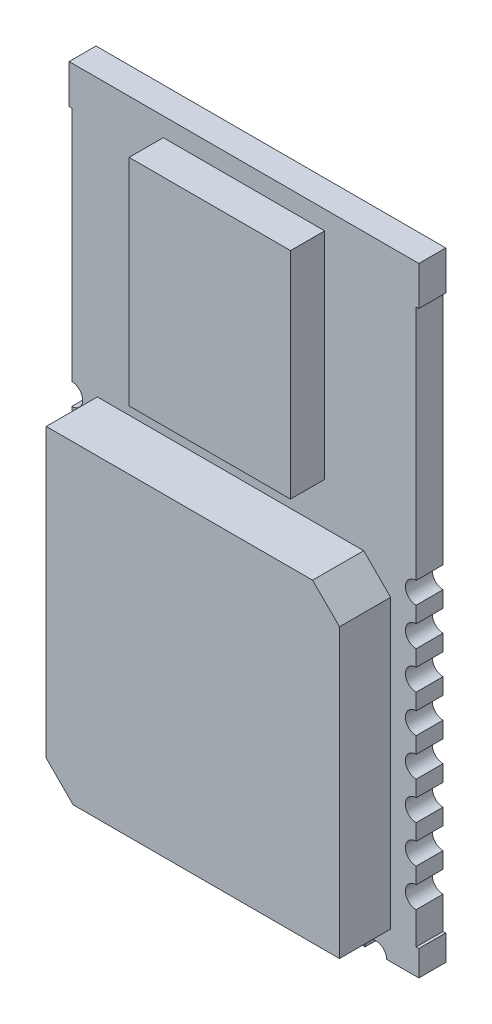
from build123d import *

# Parameters (mm, degrees)
SKETCH_1_W             = 13
SKETCH_1_H             = 23
EXTRUDE_1_DEPTH        = 1
SKETCH_2_W             = 1
SKETCH_2_H             = 20.6
CUT_EXTRUDE_1_DEPTH    = 0.1
CUT_EXTRUDE_3_REACH    = 15.248
PATTERN_LINEAR_8_COUNT = 4
PATTERN_LINEAR_8_PITCH = 1.4
MIRROR_3_COPY_1_REACH  = 15.248
MIRROR_3_COPY_2_REACH  = 15.248
MIRROR_3_COPY_3_REACH  = 15.248
CUT_EXTRUDE_4_REACH    = 15.248
PATTERN_LINEAR_9_COUNT = 8
PATTERN_LINEAR_9_PITCH = 1.4
MIRROR_4_COPY_1_REACH  = 15.248
MIRROR_4_COPY_2_REACH  = 15.248
MIRROR_4_COPY_3_REACH  = 15.248
MIRROR_4_COPY_4_REACH  = 15.248
MIRROR_4_COPY_5_REACH  = 15.248
MIRROR_4_COPY_6_REACH  = 15.248
MIRROR_4_COPY_7_REACH  = 15.248
SKETCH_12_W            = 10.9
SKETCH_12_H            = 11.68
EXTRUDE_2_DEPTH        = 1.9
CHAMFER_1_SIZE         = 1
CHAMFER_2_SIZE         = 1
SKETCH_13_W            = 6
SKETCH_13_H            = 8
EXTRUDE_3_DEPTH        = 1.27


with BuildPart() as part:
    # 草图1 → 凸台-拉伸1 (new body)
    with BuildSketch(Plane.XY):
        Rectangle(SKETCH_1_W, SKETCH_1_H)
    extrude(amount=-EXTRUDE_1_DEPTH)

    # 草图2 → 切除-拉伸1 (cut)
    with BuildSketch(Plane(origin=(6.5, 0, 0), x_dir=(0, 0, -1), z_dir=(1, 0, 0))):
        with Locations((0.5, -0.25)):
            Rectangle(SKETCH_2_W, SKETCH_2_H)
    cut_extrude_1 = extrude(amount=-CUT_EXTRUDE_1_DEPTH, mode=Mode.SUBTRACT)

    # 镜向1: 切除-拉伸1 across plane
    add(cut_extrude_1.mirror(Plane.ZY), mode=Mode.SUBTRACT)

    # 草图5 → 切除-拉伸3 (cut, up to next)
    with BuildSketch(Plane.XY, mode=Mode.PRIVATE) as cut_extrude_3_sk1:
        with BuildLine():
            Line((0.3, -11.5), (1.1, -11.5))
            ThreePointArc((1.1, -11.5), (0.7, -11.1), (0.3, -11.5))
        make_face()
    cut_extrude_3_tool1 = extrude(cut_extrude_3_sk1.sketch, amount=-CUT_EXTRUDE_3_REACH, mode=Mode.PRIVATE) & part.part
    cut_extrude_3 = cut_extrude_3_tool1.solids().sort_by_distance((0.7, -11.330235, 0))[0]
    add(cut_extrude_3, mode=Mode.SUBTRACT)

    # 阵列(线性)8: 切除-拉伸3 ×4
    with Locations(*[(i * PATTERN_LINEAR_8_PITCH, 0, 0) for i in range(1, PATTERN_LINEAR_8_COUNT)]):
        add(cut_extrude_3, mode=Mode.SUBTRACT)

    # 镜向3: 切除-拉伸3 across plane
    add(cut_extrude_3.mirror(Plane.ZY), mode=Mode.SUBTRACT)

    # 镜向3 copy 1 sketch → 镜向3 copy 1 (cut, up to next)
    with BuildSketch(Plane(origin=(-1.4, 0, 0), x_dir=(-1, 0, 0), z_dir=(0, 0, 1)), mode=Mode.PRIVATE) as mirror_3_copy_1_sk1:
        with BuildLine():
            Line((0.3, 11.5), (1.1, 11.5))
            ThreePointArc((1.1, 11.5), (0.7, 11.1), (0.3, 11.5))
        make_face()
    mirror_3_copy_1_tool1 = extrude(mirror_3_copy_1_sk1.sketch, amount=-MIRROR_3_COPY_1_REACH, mode=Mode.PRIVATE) & part.part
    add(mirror_3_copy_1_tool1.solids().sort_by_distance((-2.1, -11.330235, 0))[0], mode=Mode.SUBTRACT)

    # 镜向3 copy 2 sketch → 镜向3 copy 2 (cut, up to next)
    with BuildSketch(Plane(origin=(-2.8, 0, 0), x_dir=(-1, 0, 0), z_dir=(0, 0, 1)), mode=Mode.PRIVATE) as mirror_3_copy_2_sk1:
        with BuildLine():
            Line((0.3, 11.5), (1.1, 11.5))
            ThreePointArc((1.1, 11.5), (0.7, 11.1), (0.3, 11.5))
        make_face()
    mirror_3_copy_2_tool1 = extrude(mirror_3_copy_2_sk1.sketch, amount=-MIRROR_3_COPY_2_REACH, mode=Mode.PRIVATE) & part.part
    add(mirror_3_copy_2_tool1.solids().sort_by_distance((-3.5, -11.330235, 0))[0], mode=Mode.SUBTRACT)

    # 镜向3 copy 3 sketch → 镜向3 copy 3 (cut, up to next)
    with BuildSketch(Plane(origin=(-4.2, 0, 0), x_dir=(-1, 0, 0), z_dir=(0, 0, 1)), mode=Mode.PRIVATE) as mirror_3_copy_3_sk1:
        with BuildLine():
            Line((0.3, 11.5), (1.1, 11.5))
            ThreePointArc((1.1, 11.5), (0.7, 11.1), (0.3, 11.5))
        make_face()
    mirror_3_copy_3_tool1 = extrude(mirror_3_copy_3_sk1.sketch, amount=-MIRROR_3_COPY_3_REACH, mode=Mode.PRIVATE) & part.part
    add(mirror_3_copy_3_tool1.solids().sort_by_distance((-4.9, -11.330235, 0))[0], mode=Mode.SUBTRACT)

    # 草图11 → 切除-拉伸4 (cut, up to next)
    with BuildSketch(Plane.XY, mode=Mode.PRIVATE) as cut_extrude_4_sk1:
        with BuildLine():
            Line((-6.4, -8.55), (-6.4, -9.35))
            ThreePointArc((-6.4, -9.35), (-6, -8.95), (-6.4, -8.55))
        make_face()
    cut_extrude_4_tool1 = extrude(cut_extrude_4_sk1.sketch, amount=-CUT_EXTRUDE_4_REACH, mode=Mode.PRIVATE) & part.part
    cut_extrude_4 = cut_extrude_4_tool1.solids().sort_by_distance((-6.230235, -8.95, 0))[0]
    add(cut_extrude_4, mode=Mode.SUBTRACT)

    # 阵列(线性)9: 切除-拉伸4 ×8
    with Locations(*[(0, i * PATTERN_LINEAR_9_PITCH, 0) for i in range(1, PATTERN_LINEAR_9_COUNT)]):
        add(cut_extrude_4, mode=Mode.SUBTRACT)

    # 镜向4: 切除-拉伸4 across plane
    add(cut_extrude_4.mirror(Plane.ZY), mode=Mode.SUBTRACT)

    # 镜向4 copy 1 sketch → 镜向4 copy 1 (cut, up to next)
    with BuildSketch(Plane(origin=(0, 1.4, 0), x_dir=(-1, 0, 0), z_dir=(0, 0, 1)), mode=Mode.PRIVATE) as mirror_4_copy_1_sk1:
        with BuildLine():
            Line((-6.4, 8.55), (-6.4, 9.35))
            ThreePointArc((-6.4, 9.35), (-6, 8.95), (-6.4, 8.55))
        make_face()
    mirror_4_copy_1_tool1 = extrude(mirror_4_copy_1_sk1.sketch, amount=-MIRROR_4_COPY_1_REACH, mode=Mode.PRIVATE) & part.part
    add(mirror_4_copy_1_tool1.solids().sort_by_distance((6.230235, -7.55, 0))[0], mode=Mode.SUBTRACT)

    # 镜向4 copy 2 sketch → 镜向4 copy 2 (cut, up to next)
    with BuildSketch(Plane(origin=(0, 2.8, 0), x_dir=(-1, 0, 0), z_dir=(0, 0, 1)), mode=Mode.PRIVATE) as mirror_4_copy_2_sk1:
        with BuildLine():
            Line((-6.4, 8.55), (-6.4, 9.35))
            ThreePointArc((-6.4, 9.35), (-6, 8.95), (-6.4, 8.55))
        make_face()
    mirror_4_copy_2_tool1 = extrude(mirror_4_copy_2_sk1.sketch, amount=-MIRROR_4_COPY_2_REACH, mode=Mode.PRIVATE) & part.part
    add(mirror_4_copy_2_tool1.solids().sort_by_distance((6.230235, -6.15, 0))[0], mode=Mode.SUBTRACT)

    # 镜向4 copy 3 sketch → 镜向4 copy 3 (cut, up to next)
    with BuildSketch(Plane(origin=(0, 4.2, 0), x_dir=(-1, 0, 0), z_dir=(0, 0, 1)), mode=Mode.PRIVATE) as mirror_4_copy_3_sk1:
        with BuildLine():
            Line((-6.4, 8.55), (-6.4, 9.35))
            ThreePointArc((-6.4, 9.35), (-6, 8.95), (-6.4, 8.55))
        make_face()
    mirror_4_copy_3_tool1 = extrude(mirror_4_copy_3_sk1.sketch, amount=-MIRROR_4_COPY_3_REACH, mode=Mode.PRIVATE) & part.part
    add(mirror_4_copy_3_tool1.solids().sort_by_distance((6.230235, -4.75, 0))[0], mode=Mode.SUBTRACT)

    # 镜向4 copy 4 sketch → 镜向4 copy 4 (cut, up to next)
    with BuildSketch(Plane(origin=(0, 5.6, 0), x_dir=(-1, 0, 0), z_dir=(0, 0, 1)), mode=Mode.PRIVATE) as mirror_4_copy_4_sk1:
        with BuildLine():
            Line((-6.4, 8.55), (-6.4, 9.35))
            ThreePointArc((-6.4, 9.35), (-6, 8.95), (-6.4, 8.55))
        make_face()
    mirror_4_copy_4_tool1 = extrude(mirror_4_copy_4_sk1.sketch, amount=-MIRROR_4_COPY_4_REACH, mode=Mode.PRIVATE) & part.part
    add(mirror_4_copy_4_tool1.solids().sort_by_distance((6.230235, -3.35, 0))[0], mode=Mode.SUBTRACT)

    # 镜向4 copy 5 sketch → 镜向4 copy 5 (cut, up to next)
    with BuildSketch(Plane(origin=(0, 7, 0), x_dir=(-1, 0, 0), z_dir=(0, 0, 1)), mode=Mode.PRIVATE) as mirror_4_copy_5_sk1:
        with BuildLine():
            Line((-6.4, 8.55), (-6.4, 9.35))
            ThreePointArc((-6.4, 9.35), (-6, 8.95), (-6.4, 8.55))
        make_face()
    mirror_4_copy_5_tool1 = extrude(mirror_4_copy_5_sk1.sketch, amount=-MIRROR_4_COPY_5_REACH, mode=Mode.PRIVATE) & part.part
    add(mirror_4_copy_5_tool1.solids().sort_by_distance((6.230235, -1.95, 0))[0], mode=Mode.SUBTRACT)

    # 镜向4 copy 6 sketch → 镜向4 copy 6 (cut, up to next)
    with BuildSketch(Plane(origin=(0, 8.4, 0), x_dir=(-1, 0, 0), z_dir=(0, 0, 1)), mode=Mode.PRIVATE) as mirror_4_copy_6_sk1:
        with BuildLine():
            Line((-6.4, 8.55), (-6.4, 9.35))
            ThreePointArc((-6.4, 9.35), (-6, 8.95), (-6.4, 8.55))
        make_face()
    mirror_4_copy_6_tool1 = extrude(mirror_4_copy_6_sk1.sketch, amount=-MIRROR_4_COPY_6_REACH, mode=Mode.PRIVATE) & part.part
    add(mirror_4_copy_6_tool1.solids().sort_by_distance((6.230235, -0.55, 0))[0], mode=Mode.SUBTRACT)

    # 镜向4 copy 7 sketch → 镜向4 copy 7 (cut, up to next)
    with BuildSketch(Plane(origin=(0, 9.8, 0), x_dir=(-1, 0, 0), z_dir=(0, 0, 1)), mode=Mode.PRIVATE) as mirror_4_copy_7_sk1:
        with BuildLine():
            Line((-6.4, 8.55), (-6.4, 9.35))
            ThreePointArc((-6.4, 9.35), (-6, 8.95), (-6.4, 8.55))
        make_face()
    mirror_4_copy_7_tool1 = extrude(mirror_4_copy_7_sk1.sketch, amount=-MIRROR_4_COPY_7_REACH, mode=Mode.PRIVATE) & part.part
    add(mirror_4_copy_7_tool1.solids().sort_by_distance((6.230235, 0.85, 0))[0], mode=Mode.SUBTRACT)

    # 草图12 → 凸台-拉伸2 (add)
    with BuildSketch(Plane.XY):
        with Locations((0, -4.61)):
            Rectangle(SKETCH_12_W, SKETCH_12_H)
    extrude(amount=EXTRUDE_2_DEPTH)

    # 倒角1
    chamfer_1_edges = [part.edges().sort_by_distance(p)[0] for p in [
        (5.45, 1.23, 0.95),
    ]]
    chamfer(chamfer_1_edges, length=CHAMFER_1_SIZE)

    # 倒角2
    chamfer_2_edges = [part.edges().sort_by_distance(p)[0] for p in [
        (-5.45, -10.45, 0.95),
    ]]
    chamfer(chamfer_2_edges, length=CHAMFER_2_SIZE)

    # 草图13 → 凸台-拉伸3 (add)
    with BuildSketch(Plane.XY):
        with Locations((0, 6.8)):
            Rectangle(SKETCH_13_W, SKETCH_13_H)
    extrude(amount=EXTRUDE_3_DEPTH)


solid = part.part
